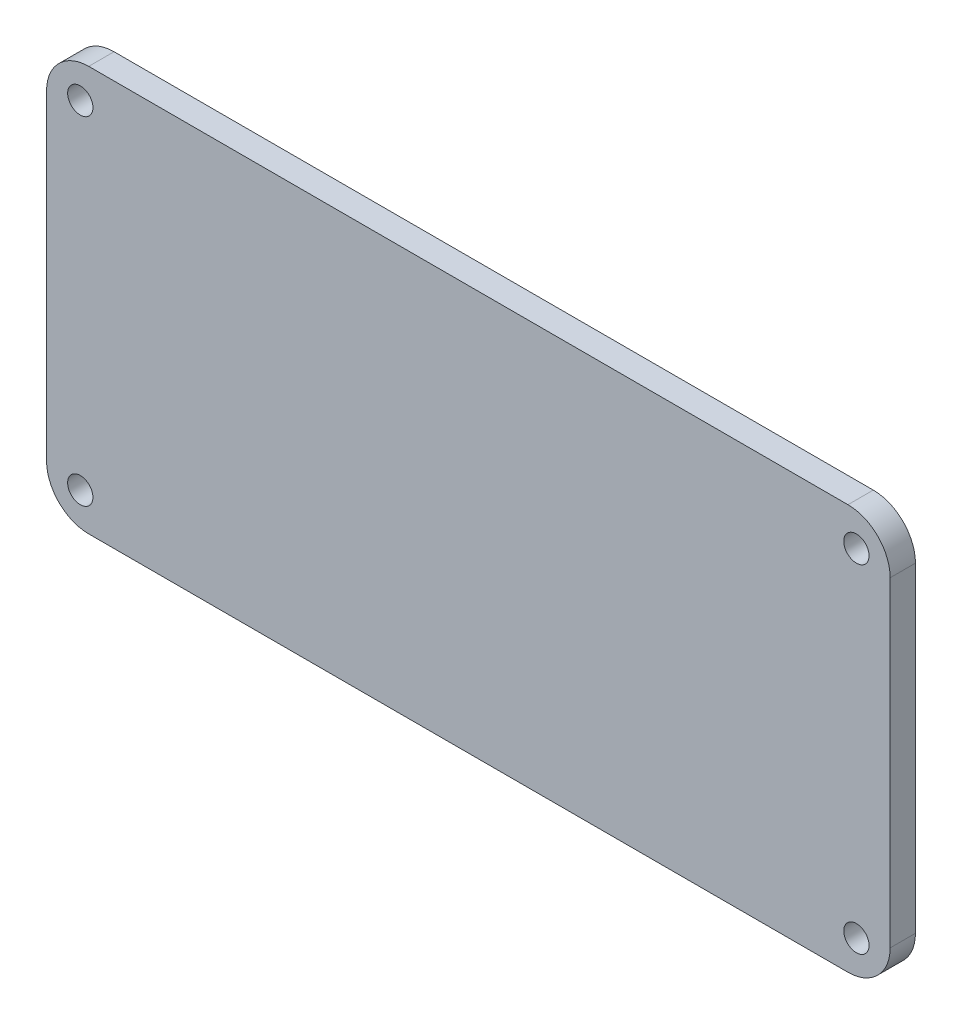
from build123d import *

# Parameters (mm, degrees)
EXTRUDE_1_DEPTH     = 3
SKETCH_2_R          = 1.5
CUT_EXTRUDE_1_DEPTH = 3


with BuildPart() as part:
    # 草图1 → 凸台-拉伸1 (new body)
    with BuildSketch(Plane.XY):
        with BuildLine():
            Line((-45, 24), (45, 24))
            ThreePointArc((45, 24), (48.535533906, 22.535533906), (50, 19))
            Line((50, 19), (50, -19))
            ThreePointArc((50, -19), (48.535533906, -22.535533906), (45, -24))
            Line((45, -24), (-45, -24))
            ThreePointArc((-45, -24), (-48.535533906, -22.535533906), (-50, -19))
            Line((-50, -19), (-50, 19))
            ThreePointArc((-50, 19), (-48.535533906, 22.535533906), (-45, 24))
        make_face()
    extrude(amount=EXTRUDE_1_DEPTH)

    # 草图2 → 切除-拉伸1 (cut)
    with BuildSketch(Plane.XY.offset(3)):
        with Locations((-46, 20)):
            Circle(SKETCH_2_R)
        with Locations((46, 20)):
            Circle(SKETCH_2_R)
        with Locations((-46, -20)):
            Circle(SKETCH_2_R)
        with Locations((46, -20)):
            Circle(SKETCH_2_R)
    extrude(amount=-CUT_EXTRUDE_1_DEPTH, mode=Mode.SUBTRACT)


solid = part.part
